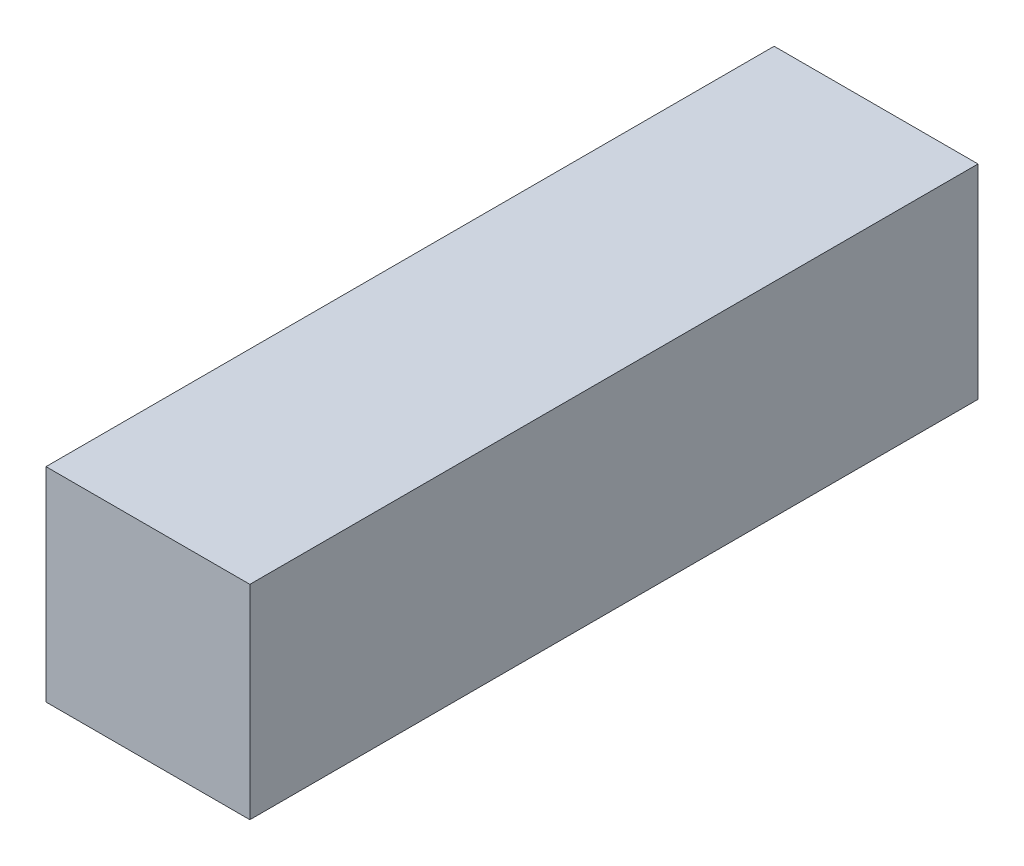
from build123d import *

# Parameters (mm, degrees)
SKETCH1_W           = 70
SKETCH1_H           = 70
BOSS_EXTRUDE1_DEPTH = 250


with BuildPart() as part:
    # Sketch1 → Boss-Extrude1 (new body)
    with BuildSketch(Plane.XY):
        Rectangle(SKETCH1_W, SKETCH1_H)
    extrude(amount=-BOSS_EXTRUDE1_DEPTH)


solid = part.part
